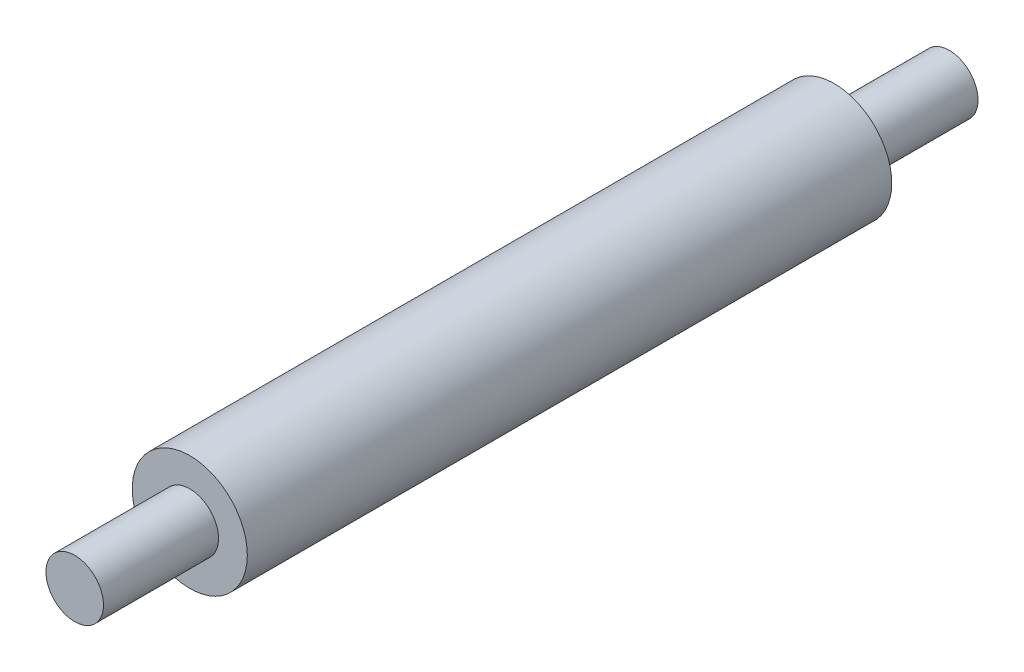
from build123d import *

# Parameters (mm, degrees)
SKETCH1_R           = 2.5
BOSS_EXTRUDE1_DEPTH = 28
SKETCH2_R           = 1.25
BOSS_EXTRUDE2_DEPTH = 5
BOSS_EXTRUDE3_START = 5
SKETCH3_R           = 1.25
BOSS_EXTRUDE3_DEPTH = 5


with BuildPart() as part:
    # Sketch1 → Boss-Extrude1 (new body)
    with BuildSketch(Plane.XY):
        Circle(SKETCH1_R)
    extrude(amount=BOSS_EXTRUDE1_DEPTH)

    # Sketch2 → Boss-Extrude2 (add)
    with BuildSketch(Plane.XY.offset(28)):
        Circle(SKETCH2_R)
    extrude(amount=BOSS_EXTRUDE2_DEPTH)

    # Sketch3 → Boss-Extrude3 (add)
    with BuildSketch(Plane(origin=(0, 0, 0), x_dir=(-1, 0, 0), z_dir=(0, 0, -1)).offset(BOSS_EXTRUDE3_START)):
        with Locations(Location((0, 0, 0), (0, 0, 180))):
            Circle(SKETCH3_R)
    extrude(amount=-BOSS_EXTRUDE3_DEPTH)


solid = part.part
